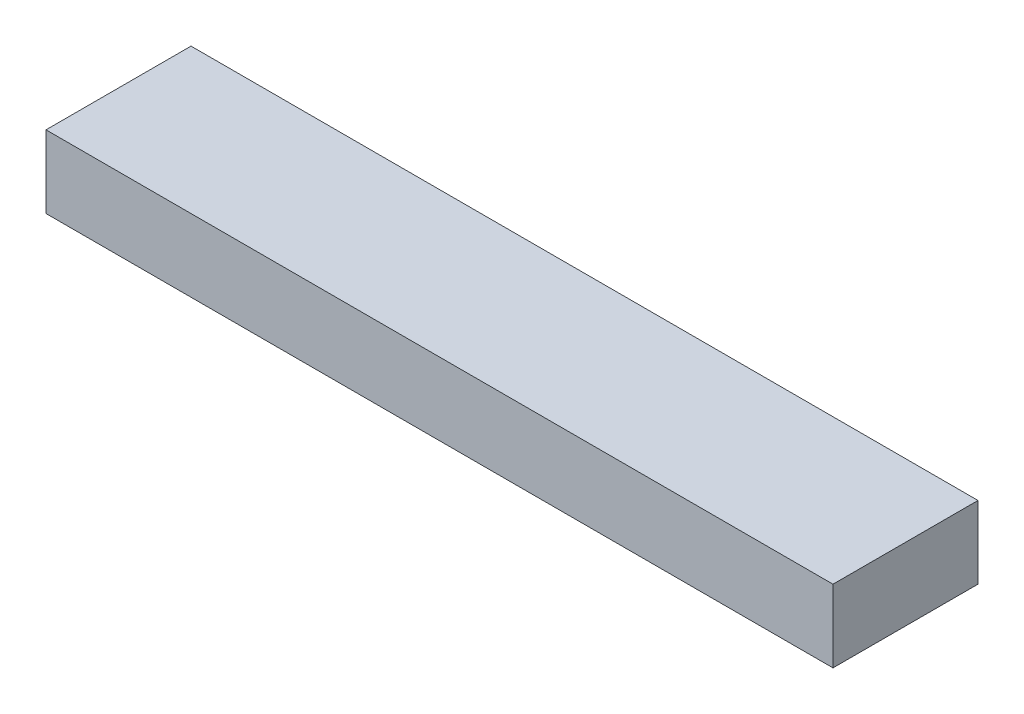
from build123d import *

# Parameters (mm, degrees)
SKETCH1_W           = 217.08
SKETCH1_H           = 20
BOSS_EXTRUDE1_DEPTH = 40
SKETCH2_R           = 5
CUT_EXTRUDE3_DEPTH  = 35


with BuildPart() as part:
    # Sketch1 → Boss-Extrude1 (new body)
    with BuildSketch(Plane.XY):
        Rectangle(SKETCH1_W, SKETCH1_H)
    extrude(amount=BOSS_EXTRUDE1_DEPTH)

    # Sketch2 → Cut-Extrude3 (cut)
    with BuildSketch(Plane.XY):
        with Locations((-56.04, 0)):
            Circle(SKETCH2_R)
        with Locations((56.04, 0)):
            Circle(SKETCH2_R)
    extrude(amount=CUT_EXTRUDE3_DEPTH, mode=Mode.SUBTRACT)


solid = part.part
